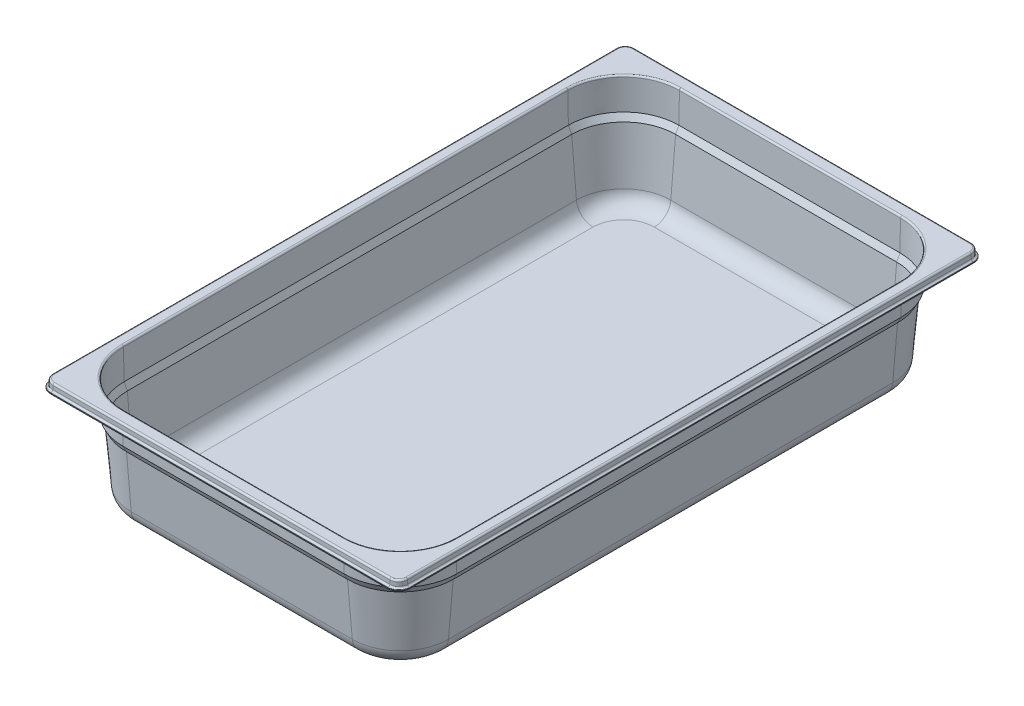
from build123d import *

# Parameters (mm, degrees)
BOSS_EXTRUDE2_DEPTH = 0.8
BOSS_EXTRUDE3_START = -0.8
BOSS_EXTRUDE3_DEPTH = 0.8


with BuildPart() as part:
    # Sweep9: sweep along a path in Sketch1
    with BuildLine(Plane(origin=(0, 0, 0), x_dir=(1, 0, 0), z_dir=(0, 1, 0))) as sweep9_path:
        Line((10, 0), (315, 0))
        ThreePointArc((315, 0), (322.071067812, 2.928932188), (325, 10))
        Line((325, 10), (325, 520))
        ThreePointArc((325, 520), (322.071067812, 527.071067812), (315, 530))
        Line((315, 530), (10, 530))
        ThreePointArc((10, 530), (2.928932188, 527.071067812), (0, 520))
        Line((0, 520), (0, 10))
        ThreePointArc((0, 10), (2.928932188, 2.928932188), (10, 0))
    # Sketch7 → Sweep9 (sweep)
    with BuildSketch(Plane.XY.offset(-10)):
        with BuildLine():
            Line((2, -5), (2, -1.5))
            ThreePointArc((2, -1.5), (2.439339828, -0.439339828), (3.5, 0))
            Line((3.5, 0), (3.5, -0.8))
            ThreePointArc((3.5, -0.8), (3.005025253, -1.005025253), (2.8, -1.5))
            Line((2.8, -1.5), (2.8, -5))
            ThreePointArc((2.8, -5), (2.126345597, -6.626345597), (0.5, -7.3))
            Line((0.5, -7.3), (0, -7.3))
            Line((0, -7.3), (0, -6.5))
            Line((0, -6.5), (0.5, -6.5))
            ThreePointArc((0.5, -6.5), (1.560660172, -6.060660172), (2, -5))
        make_face()
    sweep(path=sweep9_path.line)



with BuildPart() as body_2:
    # Sweep10: sweep along a path in Sketch9
    with BuildLine(Plane(origin=(0, 0, 0), x_dir=(1, 0, 0), z_dir=(0, 1, 0))) as sweep10_path:
        Line((62.5, 516), (262.5, 516))
        ThreePointArc((262.5, 516), (297.855339059, 501.355339059), (312.5, 466))
        Line((312.5, 466), (312.5, 64))
        ThreePointArc((312.5, 64), (297.855339059, 28.644660941), (262.5, 14))
        Line((262.5, 14), (62.5, 14))
        ThreePointArc((62.5, 14), (27.144660941, 28.644660941), (12.5, 64))
        Line((12.5, 64), (12.5, 466))
        ThreePointArc((12.5, 466), (27.144660941, 501.355339059), (62.5, 516))
    # Sketch10 → Sweep10 (sweep)
    with BuildSketch(Plane.XY.offset(-64)):
        with BuildLine():
            Line((10.527782042, 0), (10.527782042, -0.8))
            ThreePointArc((10.527782042, -0.8), (11.018418527, -1.000724686), (11.227675428, -1.487783315))
            Line((11.227675428, -1.487783315), (11.702739993, -28.704213986))
            Line((11.702739993, -28.704213986), (14.716374223, -34.430119022))
            Line((14.716374223, -34.430119022), (19.01617447, -83.577060735))
            ThreePointArc((19.01617447, -83.577060735), (24.081725419, -93.848981922), (34.756050699, -98))
            Line((34.756050699, -98), (44.756050699, -98))
            Line((44.756050699, -98), (44.756050699, -97.2))
            Line((44.756050699, -97.2), (34.756050699, -97.2))
            ThreePointArc((34.756050699, -97.2), (24.622197585, -93.259160052), (19.813130228, -83.507336141))
            Line((19.813130228, -83.507336141), (15.499297287, -34.2))
            Line((15.499297287, -34.2), (12.499297287, -28.5))
            Line((12.499297287, -28.5), (12.027553585, -1.47382139))
            ThreePointArc((12.027553585, -1.47382139), (11.579145938, -0.430124326), (10.527782042, 0))
        make_face()
    sweep(path=sweep10_path.line)


with BuildPart() as part_1:
    add(part.part)

    add(body_2.part)  # Boss-Extrude2 merges body 2
    # Sketch11 → Boss-Extrude2 (add)
    with BuildSketch(Plane(origin=(0, 0, 0), x_dir=(1, 0, 0), z_dir=(0, 1, 0))):
        with BuildLine():
            Line((321.5, 520), (321.5, 10))
            ThreePointArc((321.5, 10), (319.596194078, 5.403805922), (315, 3.5))
            Line((315, 3.5), (10, 3.5))
            ThreePointArc((10, 3.5), (5.403805922, 5.403805922), (3.5, 10))
            Line((3.5, 10), (3.5, 520))
            ThreePointArc((3.5, 520), (5.403805922, 524.596194078), (10, 526.5))
            Line((10, 526.5), (315, 526.5))
            ThreePointArc((315, 526.5), (319.596194078, 524.596194078), (321.5, 520))
        make_face()
        with BuildLine():
            Line((10.527782042, 64), (10.527782042, 466))
            ThreePointArc((10.527782042, 466), (25.750092248, 502.749907752), (62.5, 517.972217958))
            Line((62.5, 517.972217958), (262.5, 517.972217958))
            ThreePointArc((262.5, 517.972217958), (299.249907752, 502.749907752), (314.472217958, 466))
            Line((314.472217958, 466), (314.472217958, 64))
            ThreePointArc((314.472217958, 64), (299.249907752, 27.250092248), (262.5, 12.027782042))
            Line((262.5, 12.027782042), (62.5, 12.027782042))
            ThreePointArc((62.5, 12.027782042), (25.750092248, 27.250092248), (10.527782042, 64))
        make_face(mode=Mode.SUBTRACT)
    extrude(amount=-BOSS_EXTRUDE2_DEPTH)

    # Sketch12 → Boss-Extrude3 (add)
    with BuildSketch(Plane(origin=(0, -98, 0), x_dir=(-1, 0, 0), z_dir=(0, -1, 0)).offset(BOSS_EXTRUDE3_START)):
        with BuildLine():
            Line((-62.5, 483.743949301), (-262.5, 483.743949301))
            ThreePointArc((-262.5, 483.743949301), (-275.046866876, 478.546866876), (-280.243949301, 466))
            Line((-280.243949301, 466), (-280.243949301, 64))
            ThreePointArc((-280.243949301, 64), (-275.046866876, 51.453133124), (-262.5, 46.256050699))
            Line((-262.5, 46.256050699), (-62.5, 46.256050699))
            ThreePointArc((-62.5, 46.256050699), (-49.953133124, 51.453133124), (-44.756050699, 64))
            Line((-44.756050699, 64), (-44.756050699, 466))
            ThreePointArc((-44.756050699, 466), (-49.953133124, 478.546866876), (-62.5, 483.743949301))
        make_face()
    extrude(amount=BOSS_EXTRUDE3_DEPTH)


solid = part_1.part
